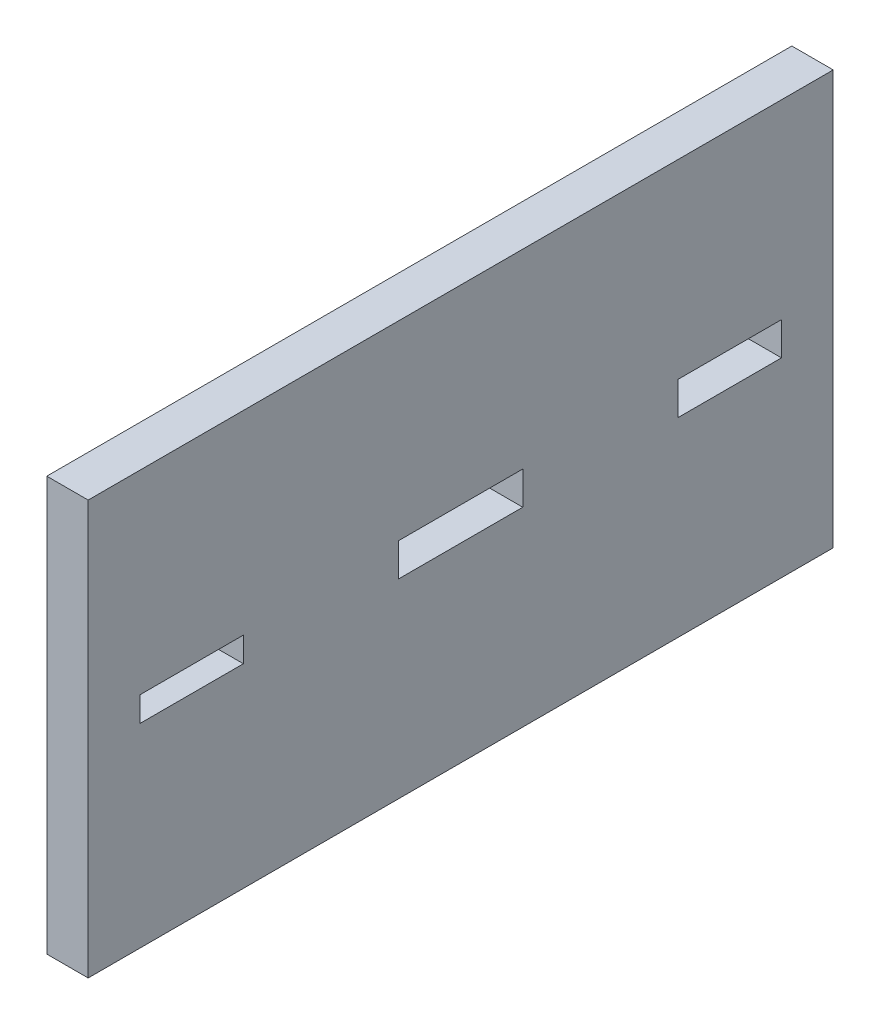
from build123d import *

# Parameters (mm, degrees)
SKETCH1_W           = 180
SKETCH1_H           = 100
SKETCH1_W_2         = 30
SKETCH1_H_2         = 8
SKETCH1_W_3         = 25
SKETCH1_H_3         = 6
BOSS_EXTRUDE1_DEPTH = 10


with BuildPart() as part:
    # Sketch1 → Boss-Extrude1 (new body)
    with BuildSketch(Plane(origin=(0, 0, 0), x_dir=(0, 0, -1), z_dir=(1, 0, 0))):
        Rectangle(SKETCH1_W, SKETCH1_H)
        Rectangle(SKETCH1_W_2, SKETCH1_H_2, mode=Mode.SUBTRACT)
        with Locations((-65, 0)):
            Rectangle(SKETCH1_W_3, SKETCH1_H_3, mode=Mode.SUBTRACT)
        with Locations((65, 0)):
            Rectangle(SKETCH1_W_3, SKETCH1_H_2, mode=Mode.SUBTRACT)
    extrude(amount=BOSS_EXTRUDE1_DEPTH)


solid = part.part
